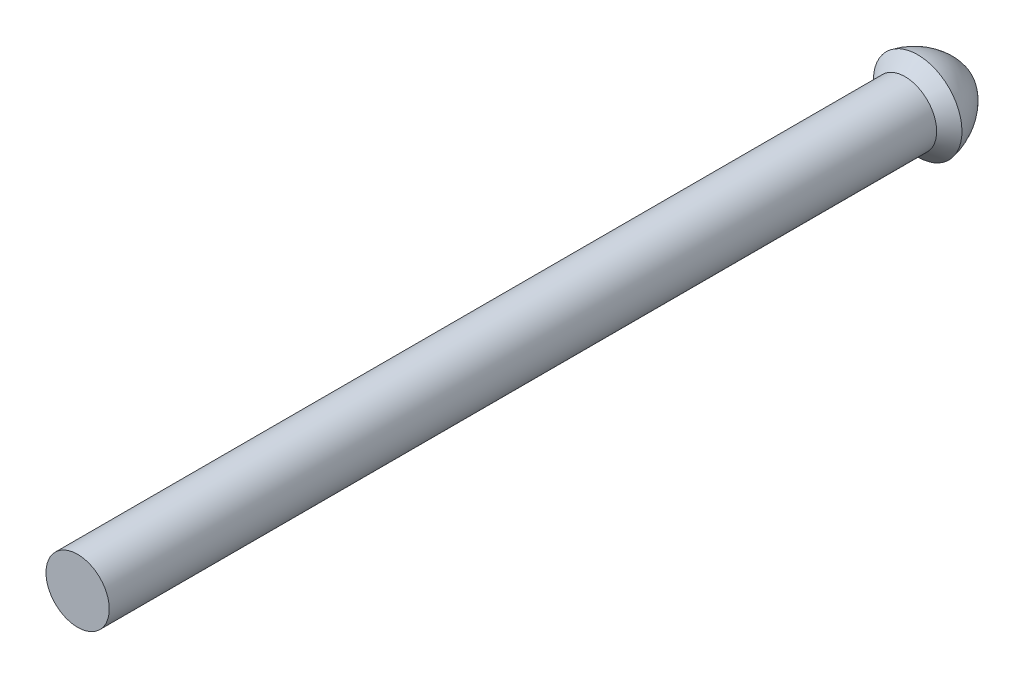
from build123d import *


with BuildPart() as part:
    # Sketch1 → Revolve2 (revolve)
    with BuildSketch(Plane(origin=(0, 0, 0), x_dir=(0, 0, -1), z_dir=(1, 0, 0)), mode=Mode.PRIVATE) as revolve2_sk:
        with BuildLine():
            Line((99.629853384, 3.81), (101.153853384, 5.334))
            ThreePointArc((101.153853384, 5.334), (104.917385939, 3.490294477), (107.237142783, 0))
            Line((107.237142783, 0), (0, 0))
            Line((0, 0), (0, 3.81))
            Line((0, 3.81), (99.629853384, 3.81))
        make_face()
    revolve(revolve2_sk.sketch.rotate(Axis((0, 0, 0), (0, 0, -1)), 180), axis=Axis((0, 0, 0), (0, 0, -1)))


solid = part.part
